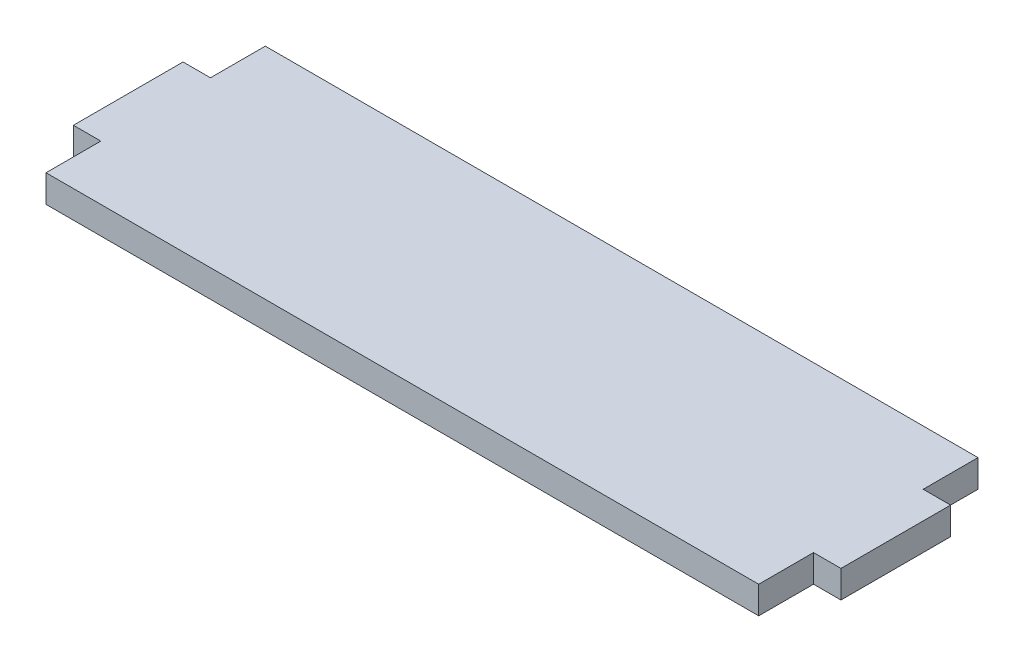
from build123d import *

# Parameters (mm, degrees)
BOSS_EXTRUDE1_DEPTH = 3.175


with BuildPart() as part:
    # Sketch1 → Boss-Extrude1 (new body)
    with BuildSketch(Plane(origin=(0, 0, 0), x_dir=(1, 0, 0), z_dir=(0, 1, 0))):
        Polygon((-41.275, 12.7), (41.275, 12.7), (41.275, 6.35), (44.45, 6.35), (44.45, -6.35), (41.275, -6.35), (41.275, -12.7), (-41.275, -12.7), (-41.275, -6.35), (-44.45, -6.35), (-44.45, 6.35), (-41.275, 6.35), align=None)
    extrude(amount=BOSS_EXTRUDE1_DEPTH)


solid = part.part
